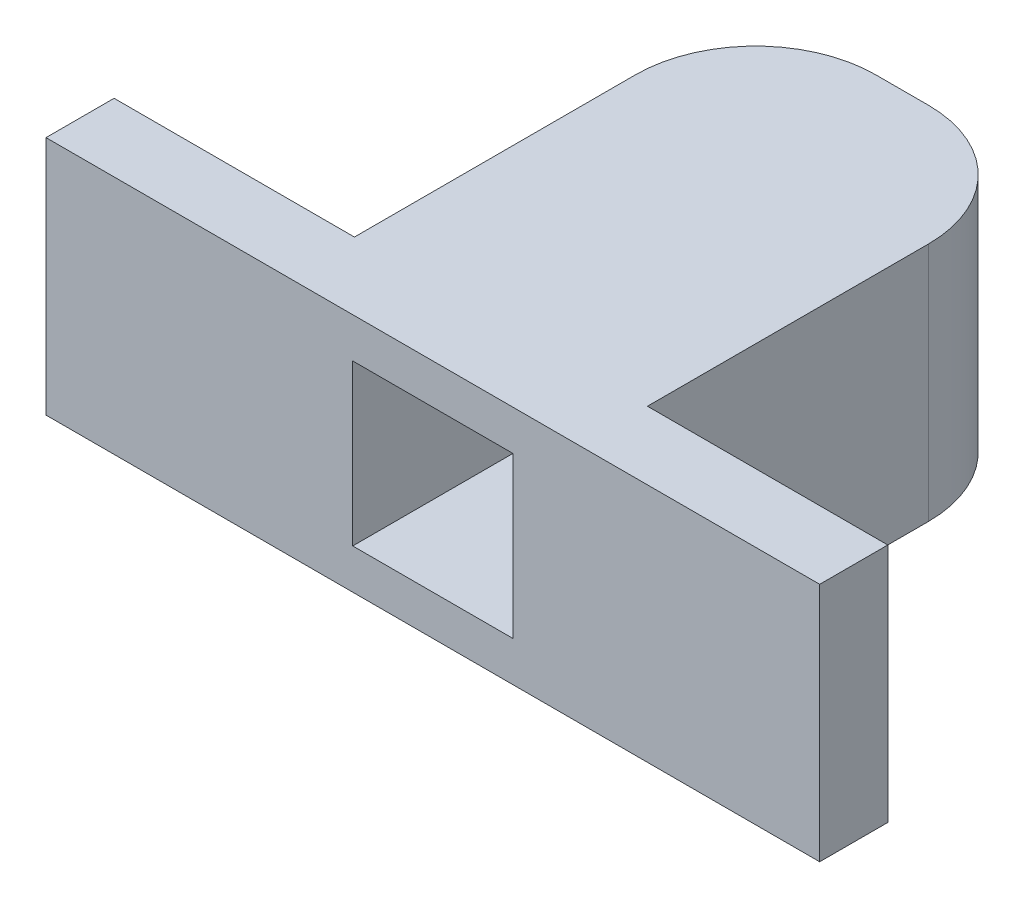
from build123d import *

# Parameters (mm, degrees)
BOSS_EXTRUDE1_DEPTH = 3
SKETCH3_W           = 2
SKETCH3_H           = 2
CUT_EXTRUDE1_DEPTH  = 5


with BuildPart() as part:
    # Sketch1 → Boss-Extrude1 (new body)
    with BuildSketch(Plane(origin=(0, 0, 0), x_dir=(1, 0, 0), z_dir=(0, 1, 0))):
        with BuildLine():
            Line((4.222106341, 0), (4.222106341, 0.85))
            Line((4.222106341, 0.85), (7.222106341, 0.85))
            Line((7.222106341, 0.85), (7.222106341, 4.357735156))
            ThreePointArc((7.222106341, 4.357735156), (7.661446169, 5.418395328), (8.722106341, 5.857735156))
            Line((8.722106341, 5.857735156), (9.380074809, 5.857735156))
            ThreePointArc((9.380074809, 5.857735156), (10.44073498, 5.418395328), (10.880074809, 4.357735156))
            Line((10.880074809, 4.357735156), (10.880074809, 0.85))
            Line((10.880074809, 0.85), (13.880074809, 0.85))
            Line((13.880074809, 0.85), (13.880074809, 0))
            Line((13.880074809, 0), (4.222106341, 0))
        make_face()
    extrude(amount=BOSS_EXTRUDE1_DEPTH)

    # Sketch3 → Cut-Extrude1 (cut)
    with BuildSketch(Plane.XY):
        with Locations((9.051090575, 1.5)):
            Rectangle(SKETCH3_W, SKETCH3_H)
    extrude(amount=-CUT_EXTRUDE1_DEPTH, mode=Mode.SUBTRACT)


solid = part.part
